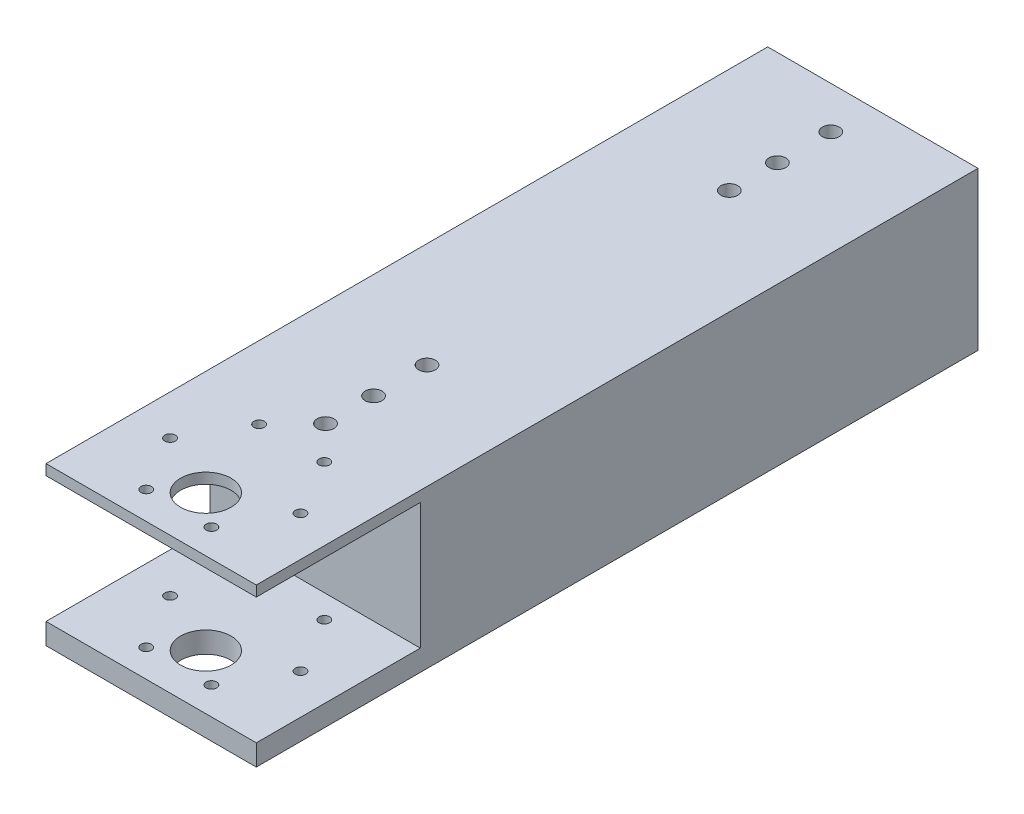
from build123d import *

# Parameters (mm, degrees)
SKETCH1_W           = 50
SKETCH1_H           = 171.6
SKETCH1_R           = 2
BOSS_EXTRUDE1_DEPTH = 37.5
CUT_EXTRUDE4_START  = -5
SKETCH2_W           = 50
SKETCH2_H           = 39
SKETCH2_R           = 6
SKETCH2_R_2         = 1.25
CUT_EXTRUDE4_DEPTH  = 30
SKETCH2_3_R         = 6
SKETCH2_3_R_2       = 1.25
CUT_EXTRUDE5_DEPTH  = 178.419869237


with BuildPart() as part:
    # Sketch1 → Boss-Extrude1 (new body)
    with BuildSketch(Plane(origin=(0, 0, 0), x_dir=(1, 0, 0), z_dir=(0, 1, 0))):
        with Locations((0, 85.8)):
            Rectangle(SKETCH1_W, SKETCH1_H)
        with Locations((0, 148.9)):
            Circle(SKETCH1_R, mode=Mode.SUBTRACT)
        with Locations((0, 161.6)):
            Circle(SKETCH1_R, mode=Mode.SUBTRACT)
        with Locations((0, 137.47)):
            Circle(SKETCH1_R, mode=Mode.SUBTRACT)
        with Locations((0, 52.888)):
            Circle(SKETCH1_R, mode=Mode.SUBTRACT)
        with Locations((0, 65.588)):
            Circle(SKETCH1_R, mode=Mode.SUBTRACT)
        with Locations((0, 41.458)):
            Circle(SKETCH1_R, mode=Mode.SUBTRACT)
    extrude(amount=BOSS_EXTRUDE1_DEPTH)

    # Sketch2 → Cut-Extrude4 (cut)
    with BuildSketch(Plane.XZ.offset(CUT_EXTRUDE4_START)):
        with Locations((0, -19.5)):
            Rectangle(SKETCH2_W, SKETCH2_H)
        with Locations((0, -13)):
            Circle(SKETCH2_R, mode=Mode.SUBTRACT)
        with Locations((-15.5, -20)):
            Circle(SKETCH2_R_2, mode=Mode.SUBTRACT)
        with Locations((-7.75, -6.576606241)):
            Circle(SKETCH2_R_2, mode=Mode.SUBTRACT)
        with Locations((7.75, -6.576606241)):
            Circle(SKETCH2_R_2, mode=Mode.SUBTRACT)
        with Locations((15.5, -20)):
            Circle(SKETCH2_R_2, mode=Mode.SUBTRACT)
        with Locations((7.75, -33.423393759)):
            Circle(SKETCH2_R_2, mode=Mode.SUBTRACT)
        with Locations((-7.75, -33.423393759)):
            Circle(SKETCH2_R_2, mode=Mode.SUBTRACT)
    extrude(amount=-CUT_EXTRUDE4_DEPTH, mode=Mode.SUBTRACT)

    # Sketch2<3> → Cut-Extrude5 (cut, through all)
    with BuildSketch(Plane.XZ):
        with Locations((0, -13)):
            Circle(SKETCH2_3_R)
        with Locations((-15.5, -20)):
            Circle(SKETCH2_3_R_2)
        with Locations((-7.75, -6.576606241)):
            Circle(SKETCH2_3_R_2)
        with Locations((7.75, -6.576606241)):
            Circle(SKETCH2_3_R_2)
        with Locations((15.5, -20)):
            Circle(SKETCH2_3_R_2)
        with Locations((7.75, -33.423393759)):
            Circle(SKETCH2_3_R_2)
        with Locations((-7.75, -33.423393759)):
            Circle(SKETCH2_3_R_2)
    extrude(amount=-CUT_EXTRUDE5_DEPTH, mode=Mode.SUBTRACT)


solid = part.part
